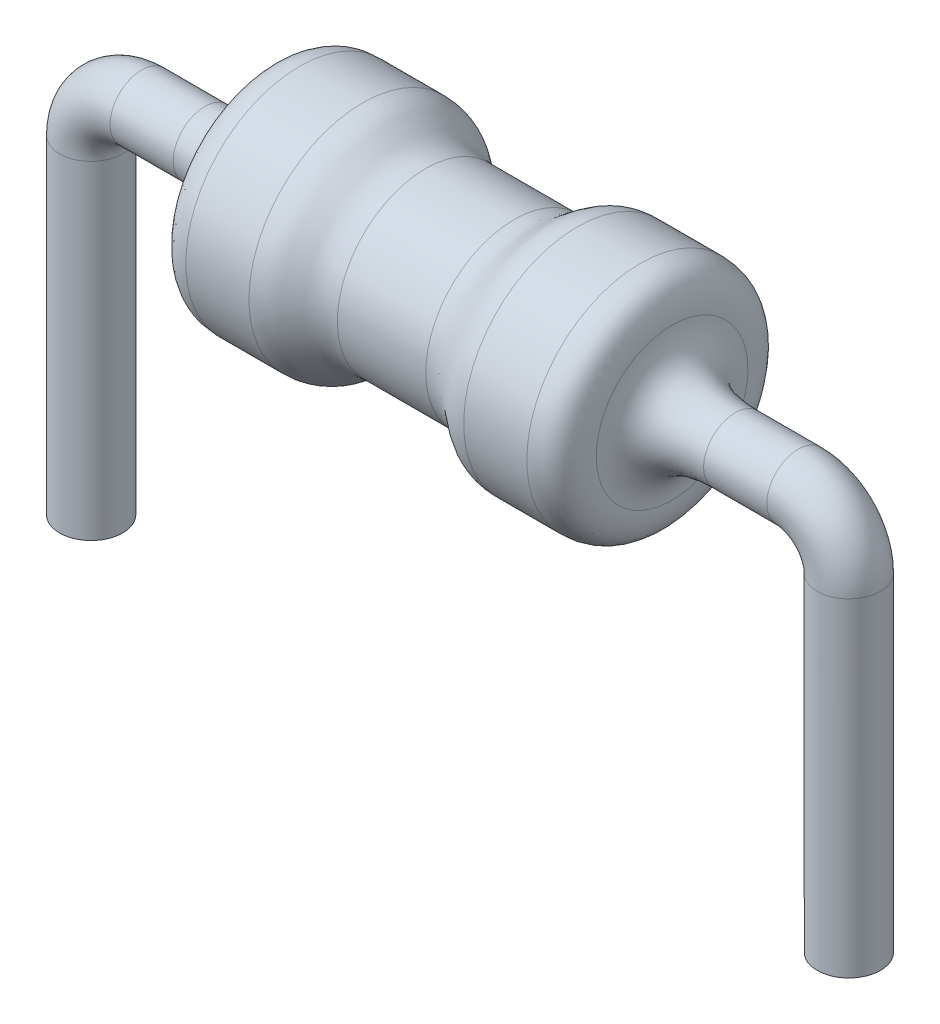
from build123d import *

# Parameters (mm, degrees)
SKETCH_3_R = 0.25


with BuildPart() as part:
    # Эскиз1 → Повернуть1 (revolve)
    with BuildSketch(Plane.XY):
        with BuildLine():
            Line((-0.35, 0.7), (0.35, 0.7))
            add(Edge.make_bspline(
                [(0.85, 0.9), (0.6, 0.9), (0.6, 0.7), (0.35, 0.7)],
                knots=[0, 0, 0, 0, 1, 1, 1, 1], degree=3))
            Line((0.85, 0.9), (1.35, 0.9))
            add(Edge.make_bspline(
                [(1.599999925, 0.600300016), (1.599897388, 0.899876961), (1.35, 0.9)],
                knots=[0, 0, 0, 1, 1, 1], degree=2))
            add(Edge.make_bspline(
                [(2.1, 0.25), (1.599859003, 0.250201318), (1.599999925, 0.600300016)],
                knots=[0, 0, 0, 1, 1, 1], degree=2))
            Line((2.1, 0.25), (2.1, 0))
            Line((2.1, 0), (-2.1, 0))
            Line((-2.1, 0), (-2.1, 0.25))
            add(Edge.make_bspline(
                [(-2.1, 0.25), (-1.599859003, 0.250201318), (-1.599999925, 0.600300016)],
                knots=[0, 0, 0, 1, 1, 1], degree=2))
            add(Edge.make_bspline(
                [(-1.599999925, 0.600300016), (-1.599897388, 0.899876961), (-1.35, 0.9)],
                knots=[0, 0, 0, 1, 1, 1], degree=2))
            Line((-1.35, 0.9), (-0.85, 0.9))
            add(Edge.make_bspline(
                [(-0.85, 0.9), (-0.6, 0.9), (-0.6, 0.7), (-0.35, 0.7)],
                knots=[0, 0, 0, 0, 1, 1, 1, 1], degree=3))
        make_face()
    revolve(axis=Axis((2.1, 0, 0), (-1, 0, 0)))

    # По траектории1: sweep along a path in Эскиз2
    with BuildLine(Plane.XY) as sweep_1_path:
        Line((0, 0), (2.6, 0))
        ThreePointArc((2.6, 0), (2.882842712, -0.117157288), (3, -0.4))
        Line((3, -0.4), (3, -3))
    # Эскиз3 → По траектории1 (sweep)
    with BuildSketch(Plane(origin=(0, -3, 0), x_dir=(1, 0, 0), z_dir=(0, 1, 0))):
        with Locations((3, 0)):
            Circle(SKETCH_3_R)
    sweep_1 = sweep(path=sweep_1_path.line)

    # Зеркальное отражение1: По траектории1 across plane
    add(sweep_1.mirror(Plane(origin=(0, 0, 0), x_dir=(0, 0, 1), z_dir=(1, 0, 0))))


solid = part.part
